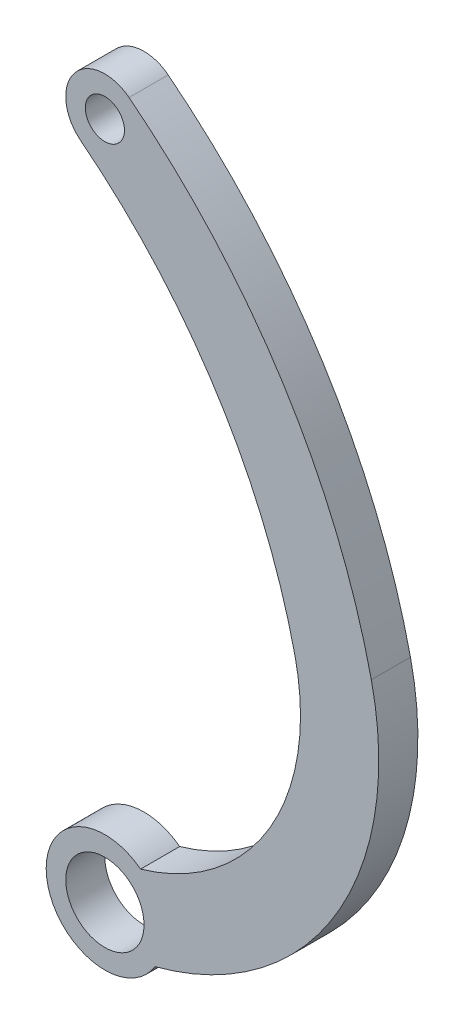
from build123d import *

# Parameters (mm, degrees)
EXTRUDE_1_DEPTH     = 6
SKETCH_2_R          = 9
EXTRUDE_2_DEPTH     = 6
SKETCH_3_R          = 6
SKETCH_3_R_2        = 3
CUT_EXTRUDE_1_DEPTH = 6


with BuildPart() as part:
    # 草图1 → 凸台-拉伸1 (new body)
    with BuildSketch(Plane.XY):
        with BuildLine():
            ThreePointArc((0.601101389, -57.969813826), (33.334648413, -39.063402424), (40.851101389, -2.016939333))
            ThreePointArc((40.851101389, -2.016939333), (27.330534013, 30.544098151), (3.708244246, 56.716876574))
            ThreePointArc((3.708244246, 56.716876574), (-4.716876574, 55.708244246), (-3.708244246, 47.283123426))
            ThreePointArc((-3.708244246, 47.283123426), (17.188396702, 24.130280975), (29.148898611, -4.673713722))
            ThreePointArc((29.148898611, -4.673713722), (23.593259455, -32.055882093), (-0.601101389, -46.030186174))
            ThreePointArc((-0.601101389, -46.030186174), (-5.969813826, -52.601101389), (0.601101389, -57.969813826))
        make_face()
    extrude(amount=EXTRUDE_1_DEPTH)

    # 草图2 → 凸台-拉伸2 (add)
    with BuildSketch(Plane.XY.offset(6)):
        with Locations((0, -52)):
            Circle(SKETCH_2_R)
    extrude(amount=-EXTRUDE_2_DEPTH)

    # 草图3 → 切除-拉伸1 (cut)
    with BuildSketch(Plane.XY.offset(6)):
        with Locations((0, -52)):
            Circle(SKETCH_3_R)
        with Locations((0, 52)):
            Circle(SKETCH_3_R_2)
    extrude(amount=-CUT_EXTRUDE_1_DEPTH, mode=Mode.SUBTRACT)


solid = part.part
